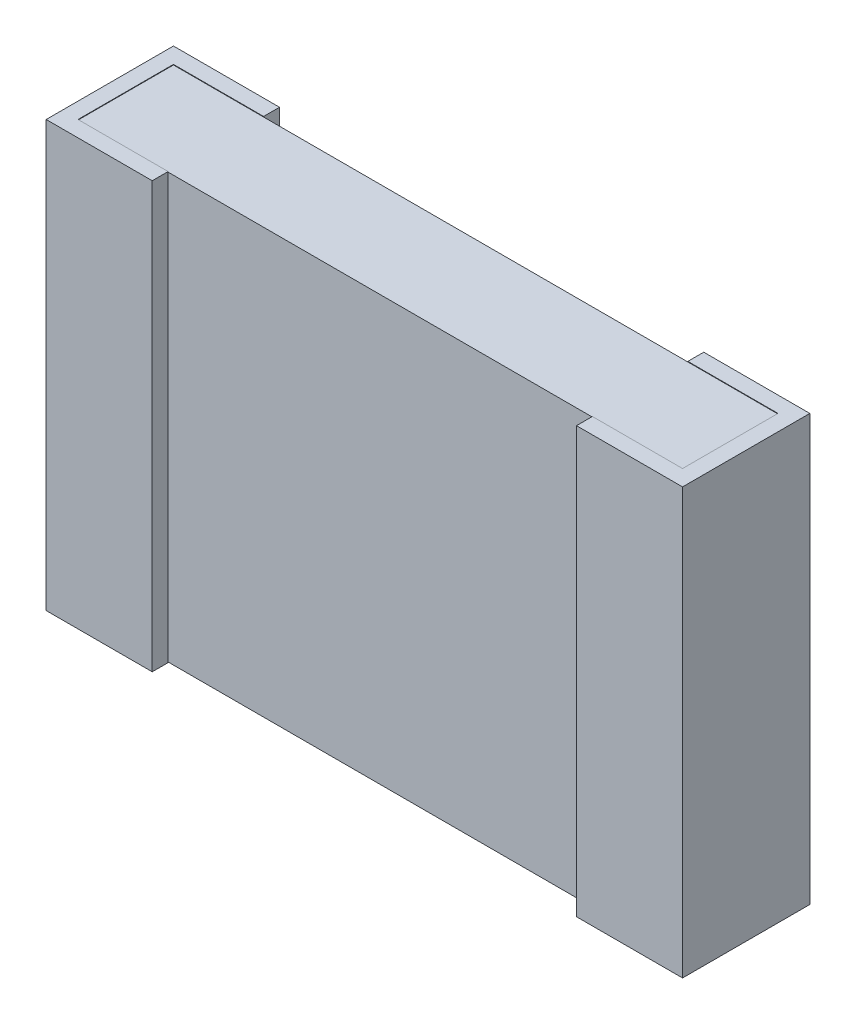
from build123d import *

# Parameters (mm, degrees)
SKETCH2_W           = 2.8956
SKETCH2_H           = 0.4572
BASE_EXTRUDE_DEPTH  = 1.016
BOSS_EXTRUDE8_DEPTH = 2.03708


with BuildPart() as part:
    # Sketch2 → Base-Extrude (new, symmetric)
    with BuildSketch(Plane(origin=(0, 0, 0), x_dir=(1, 0, 0), z_dir=(0, 1, 0))):
        with Locations((1.524, -0.3048)):
            Rectangle(SKETCH2_W, SKETCH2_H)
    extrude(amount=BASE_EXTRUDE_DEPTH, both=True)

    # Sketch3 → Boss-Extrude8 (add)
    with BuildSketch(Plane(origin=(0, 1.01854, 0), x_dir=(-1, 0, 0), z_dir=(0, 1, 0))):
        Polygon((-0.508, 0.6096), (-0.508, 0.5334), (-0.0762, 0.5334), (-0.0762, 0.0762), (-0.508, 0.0762), (-0.508, 0), (0, 0), (0, 0.6096), align=None)
    boss_extrude8 = extrude(amount=-BOSS_EXTRUDE8_DEPTH)

    # Mirror5: Boss-Extrude8 across plane
    add(boss_extrude8.mirror(Plane(origin=(1.524, 0, 0), x_dir=(0, 0, 1), z_dir=(1, 0, 0))))


solid = part.part
